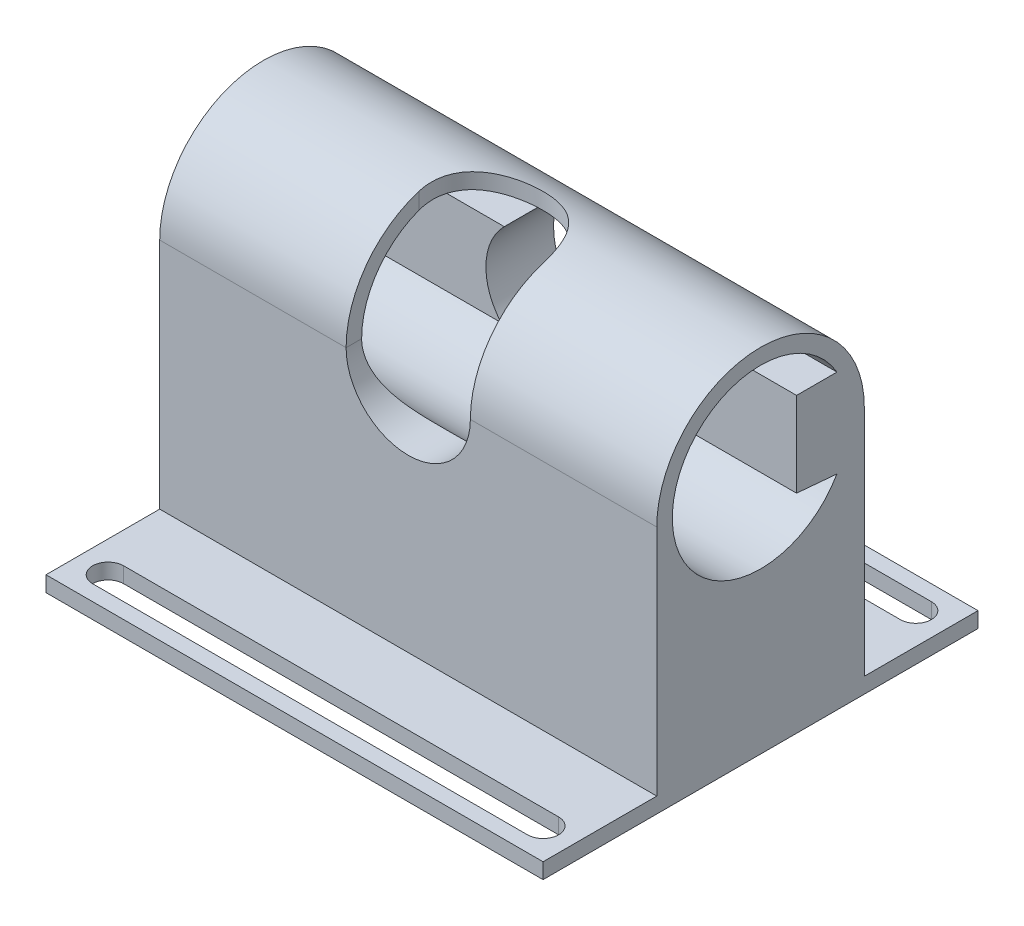
from build123d import *

# Parameters (mm, degrees)
SKETCH1_R                = 21.209
BOSS_EXTRUDE1_DEPTH      = 50.8
CUT_EXTRUDE2_DEPTH       = 59.993926484
BOSS_EXTRUDE3_REACH      = 111.794
BOSS_EXTRUDE3_END_RADIUS = 21.209
BOSS_EXTRUDE3_START      = -50.8
SKETCH4_W                = 101.6
SKETCH4_H                = 42.418
CUT_EXTRUDE1_DEPTH       = 75.907287332
CUT_EXTRUDE1_DEPTH_BACK  = 75.907287332
SKETCH2_R                = 12.7
SKETCH5_W                = 101.6
SKETCH5_H                = 88.9
BOSS_EXTRUDE4_DEPTH      = 3.175


with BuildPart() as part:
    # Sketch1 → Boss-Extrude1 (new, symmetric)
    with BuildSketch(Plane(origin=(0, 0, 0), x_dir=(0, 0, -1), z_dir=(1, 0, 0))):
        Circle(SKETCH1_R)
        with BuildLine():
            Line((15.617902132, -9.017), (7.366, -8.295052111))
            Line((7.366, -8.295052111), (7.366, 9.017))
            Line((7.366, 9.017), (15.617902132, 9.017))
            ThreePointArc((15.617902132, 9.017), (-18.034, 0), (15.617902132, -9.017))
        make_face(mode=Mode.SUBTRACT)
    extrude(amount=BOSS_EXTRUDE1_DEPTH, both=True)

    # Sketch3 → Cut-Extrude2 (cut, through all)
    with BuildSketch(Plane(origin=(0, 0, 0), x_dir=(1, 0, 0), z_dir=(0, 1, 0))):
        with BuildLine():
            Line((-12.7, -6.35), (-12.7, -32.196981008))
            Line((-12.7, -32.196981008), (12.7, -32.196981008))
            Line((12.7, -32.196981008), (12.7, -6.35))
            ThreePointArc((12.7, -6.35), (0, 6.35), (-12.7, -6.35))
        make_face()
    extrude(amount=CUT_EXTRUDE2_DEPTH, mode=Mode.SUBTRACT)

    # Boss-Extrude3: up to this cylinder (the profile starts outside it)
    boss_extrude3_end = Plane(origin=(0, 0, 0), z_dir=(-1, 0, 0)) * Cylinder(BOSS_EXTRUDE3_END_RADIUS, 267.006, mode=Mode.PRIVATE)
    # Sketch4 → Boss-Extrude3 (add, up to the surface)
    with BuildSketch(Plane(origin=(0, 0, 0), x_dir=(1, 0, 0), z_dir=(0, 1, 0)).offset(BOSS_EXTRUDE3_START), mode=Mode.PRIVATE) as boss_extrude3_sk1:
        Rectangle(SKETCH4_W, SKETCH4_H)
    boss_extrude3_tool1 = extrude(boss_extrude3_sk1.sketch, amount=BOSS_EXTRUDE3_REACH, mode=Mode.PRIVATE) - boss_extrude3_end
    add(boss_extrude3_tool1.solids().sort_by_distance((0, -50.8, 0))[0])

    # Sketch2 → Cut-Extrude1 (cut, two sides: drawn at the far end of the back side and taken through both)
    with BuildSketch(Plane.XY.offset(-CUT_EXTRUDE1_DEPTH_BACK)):
        Circle(SKETCH2_R)
    extrude(amount=CUT_EXTRUDE1_DEPTH + CUT_EXTRUDE1_DEPTH_BACK, mode=Mode.SUBTRACT)

    # Sketch5 → Boss-Extrude4 (add)
    with BuildSketch(Plane.XZ.offset(50.8)):
        Rectangle(SKETCH5_W, SKETCH5_H)
        with BuildLine():
            Line((44.45, 41.275), (-44.45, 41.275))
            ThreePointArc((-44.45, 41.275), (-47.625, 38.1), (-44.45, 34.925))
            Line((-44.45, 34.925), (44.45, 34.925))
            ThreePointArc((44.45, 34.925), (47.625, 38.1), (44.45, 41.275))
        make_face(mode=Mode.SUBTRACT)
        with BuildLine():
            Line((44.45, -41.275), (-44.45, -41.275))
            ThreePointArc((-44.45, -41.275), (-47.625, -38.1), (-44.45, -34.925))
            Line((-44.45, -34.925), (44.45, -34.925))
            ThreePointArc((44.45, -34.925), (47.625, -38.1), (44.45, -41.275))
        make_face(mode=Mode.SUBTRACT)
    extrude(amount=-BOSS_EXTRUDE4_DEPTH)


solid = part.part
